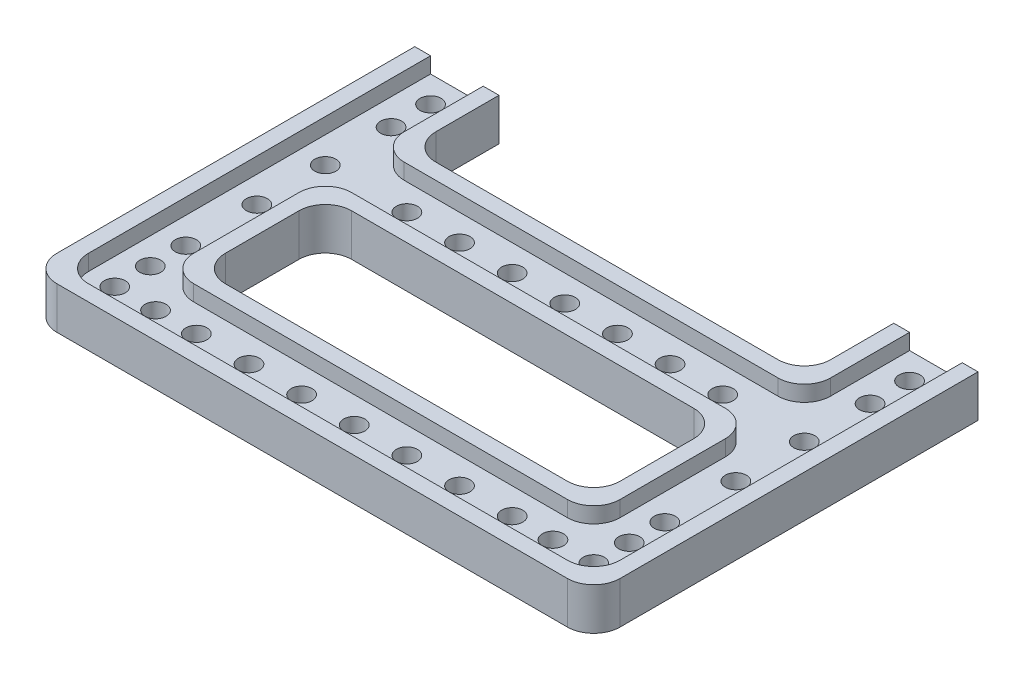
from build123d import *

# Parameters (mm, degrees)
SKETCH1_R           = 2
SKETCH1_W           = 75
SKETCH1_H           = 24
BOSS_EXTRUDE1_DEPTH = 5
SKETCH2_W           = 75
SKETCH2_H           = 24
BOSS_EXTRUDE3_DEPTH = 3
SKETCH3_R           = 2
CUT_EXTRUDE1_DEPTH  = 5
FILLET2_R           = 5
SKETCH4_R           = 2
CUT_EXTRUDE2_DEPTH  = 5
SKETCH5_R           = 4
CUT_EXTRUDE3_DEPTH  = 2


with BuildPart() as part:
    # Sketch1 → Boss-Extrude1 (new body)
    with BuildSketch(Plane(origin=(0, 0, 0), x_dir=(1, 0, 0), z_dir=(0, 1, 0))):
        Polygon((8, -48), (83, -48), (99, -48), (99, 25), (83, 25), (83, 8), (8, 8), (8, 25), (-8, 25), (-8, -48), align=None)
        with Locations(Location((0, 0, 0), (0, 0, 270))):
            Circle(SKETCH1_R, mode=Mode.SUBTRACT)
        with Locations(Location((91, 0, 0), (0, 0, 270))):
            Circle(SKETCH1_R, mode=Mode.SUBTRACT)
        with Locations(Location((0, -13, 0), (0, 0, 270))):
            Circle(SKETCH1_R, mode=Mode.SUBTRACT)
        with Locations(Location((91, -13, 0), (0, 0, 270))):
            Circle(SKETCH1_R, mode=Mode.SUBTRACT)
        with Locations((45.5, -20)):
            Rectangle(SKETCH1_W, SKETCH1_H, mode=Mode.SUBTRACT)
    extrude(amount=BOSS_EXTRUDE1_DEPTH)

    # Sketch2 → Boss-Extrude3 (add)
    # profile 1 of 3: a face of its own
    with BuildSketch(Plane(origin=(0, 5, 0), x_dir=(1, 0, 0), z_dir=(0, 1, 0))):
        Polygon((-8, 25), (-8, -48), (96, -48), (99, -48), (99, 25), (96, 25), (96, -45), (-5, -45), (-5, 25), align=None)
    # profile 2 of 3: a face of its own
    with BuildSketch(Plane(origin=(0, 5, 0), x_dir=(1, 0, 0), z_dir=(0, 1, 0))):
        Polygon((8, 25), (5, 25), (5, 8), (5, 5), (86, 5), (86, 25), (83, 25), (83, 8), (8, 8), align=None)
    # profile 3 of 3: a face of its own
    with BuildSketch(Plane(origin=(0, 5, 0), x_dir=(1, 0, 0), z_dir=(0, 1, 0))):
        Polygon((86, -5), (86, -32), (86, -35), (5, -35), (5, -5), (83, -5), align=None)
        with Locations((45.5, -20)):
            Rectangle(SKETCH2_W, SKETCH2_H, mode=Mode.SUBTRACT)
    extrude(amount=BOSS_EXTRUDE3_DEPTH)

    # Sketch3 → Cut-Extrude1 (cut)
    with BuildSketch(Plane(origin=(0, 5, 0), x_dir=(1, 0, 0), z_dir=(0, 1, 0))):
        with Locations(Location((0, -40, 0), (0, 0, 270))):
            Circle(SKETCH3_R)
        with Locations(Location((91, -40, 0), (0, 0, 270))):
            Circle(SKETCH3_R)
        with Locations(Location((91, -26.5, 0), (0, 0, 270))):
            Circle(SKETCH3_R)
        with Locations(Location((0, -26.5, 0), (0, 0, 270))):
            Circle(SKETCH3_R)
        with Locations(Location((0, 12.5, 0), (0, 0, 270))):
            Circle(SKETCH3_R)
        with Locations(Location((91, 12.5, 0), (0, 0, 270))):
            Circle(SKETCH3_R)
        with Locations(Location((0, 20, 0), (0, 0, 270))):
            Circle(SKETCH3_R)
        with Locations(Location((91, 20, 0), (0, 0, 270))):
            Circle(SKETCH3_R)
        with Locations(Location((0, -33.25, 0), (0, 0, 270))):
            Circle(SKETCH3_R)
        with Locations(Location((91, -33.25, 0), (0, 0, 270))):
            Circle(SKETCH3_R)
        with Locations(Location((75.5, 0, 0), (0, 0, 270))):
            Circle(SKETCH3_R)
        with Locations(Location((65.5, 0, 0), (0, 0, 270))):
            Circle(SKETCH3_R)
        with Locations(Location((55.5, 0, 0), (0, 0, 270))):
            Circle(SKETCH3_R)
        with Locations(Location((45.5, 0, 0), (0, 0, 270))):
            Circle(SKETCH3_R)
        with Locations(Location((35.5, 0, 0), (0, 0, 270))):
            Circle(SKETCH3_R)
        with Locations(Location((25.5, 0, 0), (0, 0, 270))):
            Circle(SKETCH3_R)
        with Locations(Location((15.5, 0, 0), (0, 0, 270))):
            Circle(SKETCH3_R)
        with Locations(Location((55.5, -40, 0), (0, 0, 270))):
            Circle(SKETCH3_R)
        with Locations(Location((45.5, -40, 0), (0, 0, 270))):
            Circle(SKETCH3_R)
        with Locations(Location((15.5, -40, 0), (0, 0, 270))):
            Circle(SKETCH3_R)
        with Locations(Location((75.5, -40, 0), (0, 0, 270))):
            Circle(SKETCH3_R)
        with Locations(Location((65.5, -40, 0), (0, 0, 270))):
            Circle(SKETCH3_R)
        with Locations(Location((25.5, -40, 0), (0, 0, 270))):
            Circle(SKETCH3_R)
        with Locations(Location((35.5, -40, 0), (0, 0, 270))):
            Circle(SKETCH3_R)
    extrude(amount=-CUT_EXTRUDE1_DEPTH, mode=Mode.SUBTRACT)

    # Fillet2
    fillet2_edges = [part.edges().sort_by_distance(p)[0] for p in [
        (5, 6.5, 5),
        (5, 6.5, 35),
        (86, 6.5, 35),
        (86, 6.5, 5),
        (8, 4, -8),
        (83, 4, -8),
        (99, 4, 48),
        (-8, 4, 48),
        (8, 4, 8),
        (8, 4, 32),
        (83, 4, 32),
        (83, 4, 8),
        (96, 6.5, 45),
        (-5, 6.5, 45),
        (5, 6.5, -5),
        (86, 6.5, -5),
    ]]
    fillet(fillet2_edges, radius=FILLET2_R)

    # Sketch4 → Cut-Extrude2 (cut)
    with BuildSketch(Plane(origin=(0, 5, 0), x_dir=(1, 0, 0), z_dir=(0, 1, 0))):
        with Locations(Location((7.75, -40, 0), (0, 0, 270))):
            Circle(SKETCH4_R)
        with Locations(Location((83.25, -40, 0), (0, 0, 270))):
            Circle(SKETCH4_R)
    extrude(amount=-CUT_EXTRUDE2_DEPTH, mode=Mode.SUBTRACT)

    # Sketch5 → Cut-Extrude3 (cut)
    with BuildSketch(Plane.XZ):
        with Locations(Location((91, 0, 0), (0, 0, 270))):
            Circle(SKETCH5_R)
        with Locations(Location((91, 13, 0), (0, 0, 270))):
            Circle(SKETCH5_R)
        with Locations(Location((0, 0, 0), (0, 0, 270))):
            Circle(SKETCH5_R)
        with Locations(Location((0, 13, 0), (0, 0, 270))):
            Circle(SKETCH5_R)
    extrude(amount=-CUT_EXTRUDE3_DEPTH, mode=Mode.SUBTRACT)


solid = part.part
